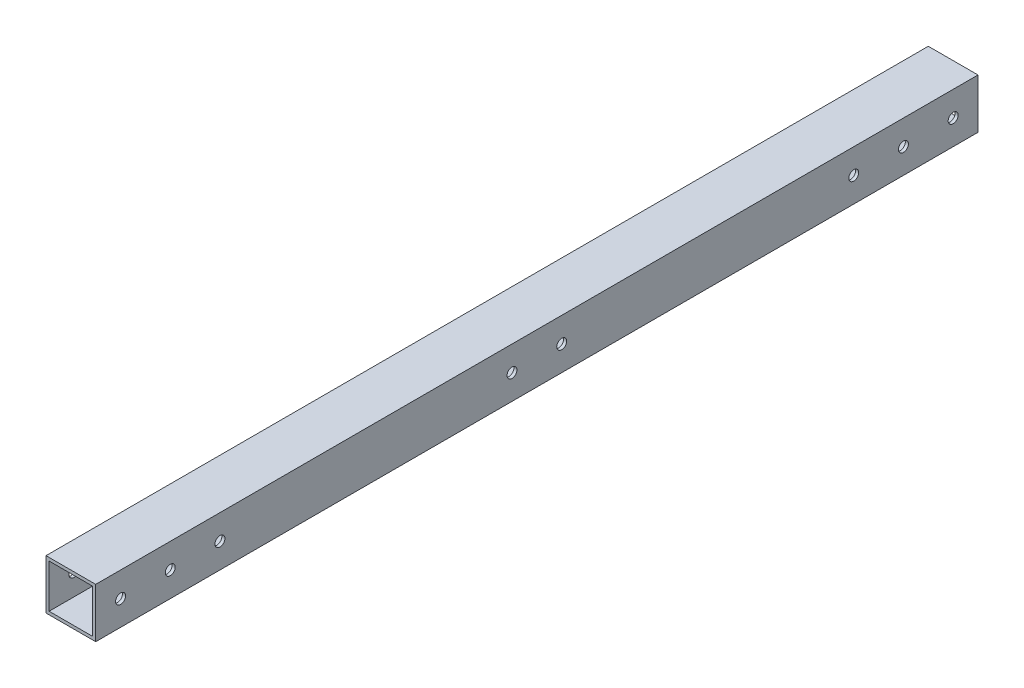
from build123d import *

# Parameters (mm, degrees)
SKETCH1_W           = 25.4
SKETCH1_H           = 25.4
SKETCH1_W_2         = 22.225
SKETCH1_H_2         = 22.225
BOSS_EXTRUDE1_DEPTH = 450.85
SKETCH4_R           = 2.54
CUT_EXTRUDE3_DEPTH  = 453.278722139


with BuildPart() as part:
    # Sketch1 → Boss-Extrude1 (new body)
    with BuildSketch(Plane.XY):
        with Locations((12.7, 12.7)):
            Rectangle(SKETCH1_W, SKETCH1_H)
        with Locations((12.7, 12.7)):
            Rectangle(SKETCH1_W_2, SKETCH1_H_2, mode=Mode.SUBTRACT)
    extrude(amount=BOSS_EXTRUDE1_DEPTH)

    # Sketch4 → Cut-Extrude3 (cut, through all)
    with BuildSketch(Plane(origin=(25.4, 0, 0), x_dir=(0, 0, -1), z_dir=(1, 0, 0))):
        with Locations((-438.15, 12.7)):
            Circle(SKETCH4_R)
        with Locations((-412.75, 12.7)):
            Circle(SKETCH4_R)
        with Locations((-387.35, 12.7)):
            Circle(SKETCH4_R)
        with Locations(Location((-63.5, 12.7, 0), (0, 0, 180))):
            Circle(SKETCH4_R)
        with Locations(Location((-38.1, 12.7, 0), (0, 0, 180))):
            Circle(SKETCH4_R)
        with Locations(Location((-12.7, 12.7, 0), (0, 0, 180))):
            Circle(SKETCH4_R)
        with Locations((-238.125, 12.7)):
            Circle(SKETCH4_R)
        with Locations(Location((-212.725, 12.7, 0), (0, 0, 180))):
            Circle(SKETCH4_R)
    extrude(amount=-CUT_EXTRUDE3_DEPTH, mode=Mode.SUBTRACT)


solid = part.part
